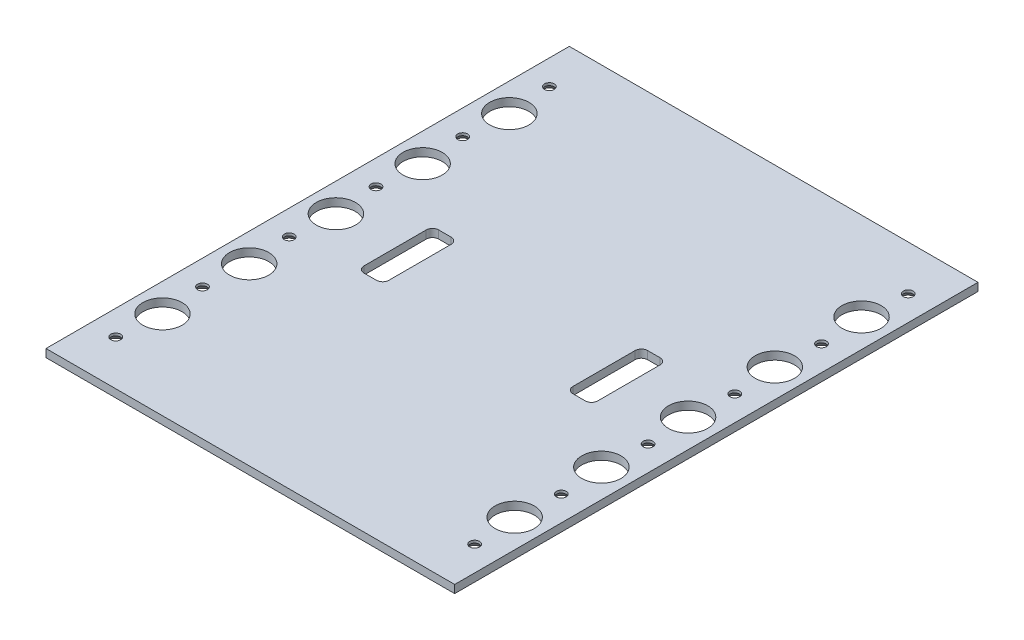
from build123d import *

# Parameters (mm, degrees)
SKETCH1_W                                    = 208.28
SKETCH1_H                                    = 266.7
BOSS_EXTRUDE1_DEPTH                          = 4.064
SKETCH2_W                                    = 12.7
SKETCH2_H                                    = 38.1
CUT_EXTRUDE1_DEPTH                           = 170.24502414
FILLET1_R                                    = 3.175
SKETCH3_R                                    = 10
CUT_EXTRUDE2_DEPTH                           = 170.24502414
CSK_FOR_10_FLAT_HEAD_MACHINE_SCREW2_AT_COUNT = 2
CSK_FOR_10_FLAT_HEAD_MACHINE_SCREW2_AT_PITCH = 220.98
CSK_FOR_10_FLAT_HEAD_MACHINE_SCREW2_2_COUNT  = 2
CSK_FOR_10_FLAT_HEAD_MACHINE_SCREW2_2_PITCH  = 176.784
CSK_FOR_10_FLAT_HEAD_MACHINE_SCREW2_3_COUNT  = 2
CSK_FOR_10_FLAT_HEAD_MACHINE_SCREW2_3_PITCH  = 132.588
CSK_FOR_10_FLAT_HEAD_MACHINE_SCREW2_4_COUNT  = 2
CSK_FOR_10_FLAT_HEAD_MACHINE_SCREW2_4_PITCH  = 88.392
CSK_FOR_10_FLAT_HEAD_MACHINE_SCREW2_5_COUNT  = 2
CSK_FOR_10_FLAT_HEAD_MACHINE_SCREW2_5_PITCH  = 44.196


with BuildPart() as part:
    # Sketch1 → Boss-Extrude1 (new body)
    with BuildSketch(Plane(origin=(0, 0, 0), x_dir=(1, 0, 0), z_dir=(0, 1, 0))):
        Rectangle(SKETCH1_W, SKETCH1_H)
    extrude(amount=BOSS_EXTRUDE1_DEPTH)

    # Sketch2 → Cut-Extrude1 (cut, through all)
    with BuildSketch(Plane(origin=(0, 4.064, 0), x_dir=(1, 0, 0), z_dir=(0, 1, 0))):
        with Locations((-53.2265001, 0)):
            Rectangle(SKETCH2_W, SKETCH2_H)
    cut_extrude1 = extrude(amount=-CUT_EXTRUDE1_DEPTH, mode=Mode.SUBTRACT)

    # Mirror1: Cut-Extrude1 across plane
    add(cut_extrude1.mirror(Plane(origin=(0, 0, 0), x_dir=(0, 0, 1), z_dir=(1, 0, 0))), mode=Mode.SUBTRACT)

    # Fillet1
    fillet1_edges = [part.edges().sort_by_distance(p)[0] for p in [
        (-46.8765001, 2.032, -19.05),
        (-46.8765001, 2.032, 19.05),
        (-59.5765001, 2.032, 19.05),
        (-59.5765001, 2.032, -19.05),
        (46.8765001, 2.032, 19.05),
        (46.8765001, 2.032, -19.05),
        (59.5765001, 2.032, -19.05),
        (59.5765001, 2.032, 19.05),
    ]]
    fillet(fillet1_edges, radius=FILLET1_R)

    # Sketch3 → Cut-Extrude2 (cut, through all)
    with BuildSketch(Plane(origin=(0, 0, 0), x_dir=(1, 0, 0), z_dir=(0, 1, 0))):
        with Locations(Location((-89.74, 88.392, 0), (0, 0, 270))):
            Circle(SKETCH3_R)
        with Locations(Location((-89.74, 44.196, 0), (0, 0, 270))):
            Circle(SKETCH3_R)
        with Locations(Location((-89.74, 0, 0), (0, 0, 270))):
            Circle(SKETCH3_R)
        with Locations(Location((-89.74, -44.196, 0), (0, 0, 270))):
            Circle(SKETCH3_R)
        with Locations(Location((-89.74, -88.392, 0), (0, 0, 270))):
            Circle(SKETCH3_R)
    cut_extrude2 = extrude(amount=CUT_EXTRUDE2_DEPTH, mode=Mode.SUBTRACT)

    # Sketch10 → CSK for #10 Flat Head Machine Screw2 (revolve, cut)
    with BuildSketch(Plane(origin=(-91.44, 0, -110.49), x_dir=(0, 0, -1), z_dir=(1, 0, 0))):
        Polygon((0, 0), (0, 12.417662253), (2.4892, 10.922), (2.4892, 2.761229288), (4.8895, 0), align=None)
    csk_for_10_flat_head_machine_screw2 = revolve(axis=Axis((-91.44, -6.35, -110.49), (0, 1, 0)), mode=Mode.SUBTRACT)

    # CSK for #10 Flat Head Machine Screw2 at: CSK for #10 Flat Head Machine Screw2 ×2
    with Locations(*[(0, 0, i * CSK_FOR_10_FLAT_HEAD_MACHINE_SCREW2_AT_PITCH) for i in range(1, CSK_FOR_10_FLAT_HEAD_MACHINE_SCREW2_AT_COUNT)]):
        add(csk_for_10_flat_head_machine_screw2, mode=Mode.SUBTRACT)

    # CSK for _10 Flat Head Machine Screw2 2: CSK for #10 Flat Head Machine Screw2 ×2
    with Locations(*[(0, 0, i * CSK_FOR_10_FLAT_HEAD_MACHINE_SCREW2_2_PITCH) for i in range(1, CSK_FOR_10_FLAT_HEAD_MACHINE_SCREW2_2_COUNT)]):
        add(csk_for_10_flat_head_machine_screw2, mode=Mode.SUBTRACT)

    # CSK for _10 Flat Head Machine Screw2 3: CSK for #10 Flat Head Machine Screw2 ×2
    with Locations(*[(0, 0, i * CSK_FOR_10_FLAT_HEAD_MACHINE_SCREW2_3_PITCH) for i in range(1, CSK_FOR_10_FLAT_HEAD_MACHINE_SCREW2_3_COUNT)]):
        add(csk_for_10_flat_head_machine_screw2, mode=Mode.SUBTRACT)

    # CSK for _10 Flat Head Machine Screw2 4: CSK for #10 Flat Head Machine Screw2 ×2
    with Locations(*[(0, 0, i * CSK_FOR_10_FLAT_HEAD_MACHINE_SCREW2_4_PITCH) for i in range(1, CSK_FOR_10_FLAT_HEAD_MACHINE_SCREW2_4_COUNT)]):
        add(csk_for_10_flat_head_machine_screw2, mode=Mode.SUBTRACT)

    # CSK for _10 Flat Head Machine Screw2 5: CSK for #10 Flat Head Machine Screw2 ×2
    with Locations(*[(0, 0, i * CSK_FOR_10_FLAT_HEAD_MACHINE_SCREW2_5_PITCH) for i in range(1, CSK_FOR_10_FLAT_HEAD_MACHINE_SCREW2_5_COUNT)]):
        add(csk_for_10_flat_head_machine_screw2, mode=Mode.SUBTRACT)

    # Mirror2: Cut-Extrude2, CSK for #10 Flat Head Machine Screw2 across plane
    add(cut_extrude2.mirror(Plane(origin=(0, 0, 0), x_dir=(0, 0, 1), z_dir=(1, 0, 0))), mode=Mode.SUBTRACT)
    add(csk_for_10_flat_head_machine_screw2.mirror(Plane(origin=(0, 0, 0), x_dir=(0, 0, 1), z_dir=(1, 0, 0))), mode=Mode.SUBTRACT)

    # Mirror2 copy 1 sketch → Mirror2 copy 1 (revolve, cut)
    with BuildSketch(Plane(origin=(91.44, 0, 110.49), x_dir=(0, 0, -1), z_dir=(-1, 0, 0))):
        Polygon((0, 0), (0, -12.417662253), (2.4892, -10.922), (2.4892, -2.761229288), (4.8895, 0), align=None)
    revolve(axis=Axis((91.44, -6.35, 110.49), (0, -1, 0)), mode=Mode.SUBTRACT)

    # Mirror2 copy 2 sketch → Mirror2 copy 2 (revolve, cut)
    with BuildSketch(Plane(origin=(91.44, 0, 66.294), x_dir=(0, 0, -1), z_dir=(-1, 0, 0))):
        Polygon((0, 0), (0, -12.417662253), (2.4892, -10.922), (2.4892, -2.761229288), (4.8895, 0), align=None)
    revolve(axis=Axis((91.44, -6.35, 66.294), (0, -1, 0)), mode=Mode.SUBTRACT)

    # Mirror2 copy 3 sketch → Mirror2 copy 3 (revolve, cut)
    with BuildSketch(Plane(origin=(91.44, 0, 22.098), x_dir=(0, 0, -1), z_dir=(-1, 0, 0))):
        Polygon((0, 0), (0, -12.417662253), (2.4892, -10.922), (2.4892, -2.761229288), (4.8895, 0), align=None)
    revolve(axis=Axis((91.44, -6.35, 22.098), (0, -1, 0)), mode=Mode.SUBTRACT)

    # Mirror2 copy 4 sketch → Mirror2 copy 4 (revolve, cut)
    with BuildSketch(Plane(origin=(91.44, 0, -22.098), x_dir=(0, 0, -1), z_dir=(-1, 0, 0))):
        Polygon((0, 0), (0, -12.417662253), (2.4892, -10.922), (2.4892, -2.761229288), (4.8895, 0), align=None)
    revolve(axis=Axis((91.44, -6.35, -22.098), (0, -1, 0)), mode=Mode.SUBTRACT)

    # Mirror2 copy 5 sketch → Mirror2 copy 5 (revolve, cut)
    with BuildSketch(Plane(origin=(91.44, 0, -66.294), x_dir=(0, 0, -1), z_dir=(-1, 0, 0))):
        Polygon((0, 0), (0, -12.417662253), (2.4892, -10.922), (2.4892, -2.761229288), (4.8895, 0), align=None)
    revolve(axis=Axis((91.44, -6.35, -66.294), (0, -1, 0)), mode=Mode.SUBTRACT)


solid = part.part
